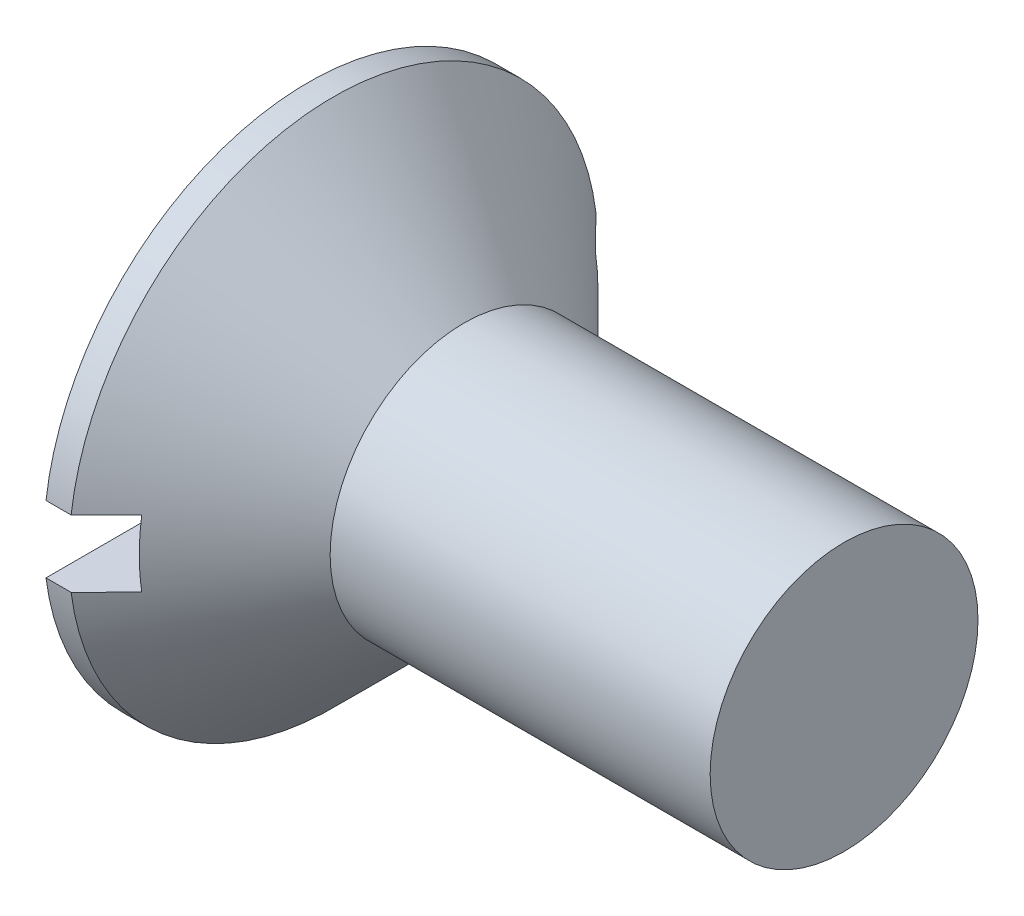
from build123d import *

# Parameters (mm, degrees)
CUT_EXTRUDE_1_DEPTH      = 20.514609912
CUT_EXTRUDE_1_DEPTH_BACK = 20.514609912
SKETCH_2_W               = 2.289640131
SKETCH_2_H               = 2


with BuildPart() as part:
    # 草图1 → 旋转1 (revolve)
    with BuildSketch(Plane.XY, mode=Mode.PRIVATE) as revolve_1_sk:
        Polygon((0, 0), (0, 7.9), (0.75, 7.9), (4.65, 4), (16, 4), (16, 0), align=None)
    revolve(revolve_1_sk.sketch.rotate(Axis((-3.228581577, 0, 0), (1, 0, 0)), 90), axis=Axis((-3.228581577, 0, 0), (1, 0, 0)))

    # 草图2 → 切除-拉伸1 (cut, two sides: drawn at the far end of the back side and taken through both)
    with BuildSketch(Plane.XY.offset(-CUT_EXTRUDE_1_DEPTH_BACK)):
        with Locations((0.655179935, 0)):
            Rectangle(SKETCH_2_W, SKETCH_2_H)
    extrude(amount=CUT_EXTRUDE_1_DEPTH + CUT_EXTRUDE_1_DEPTH_BACK, mode=Mode.SUBTRACT)


solid = part.part
